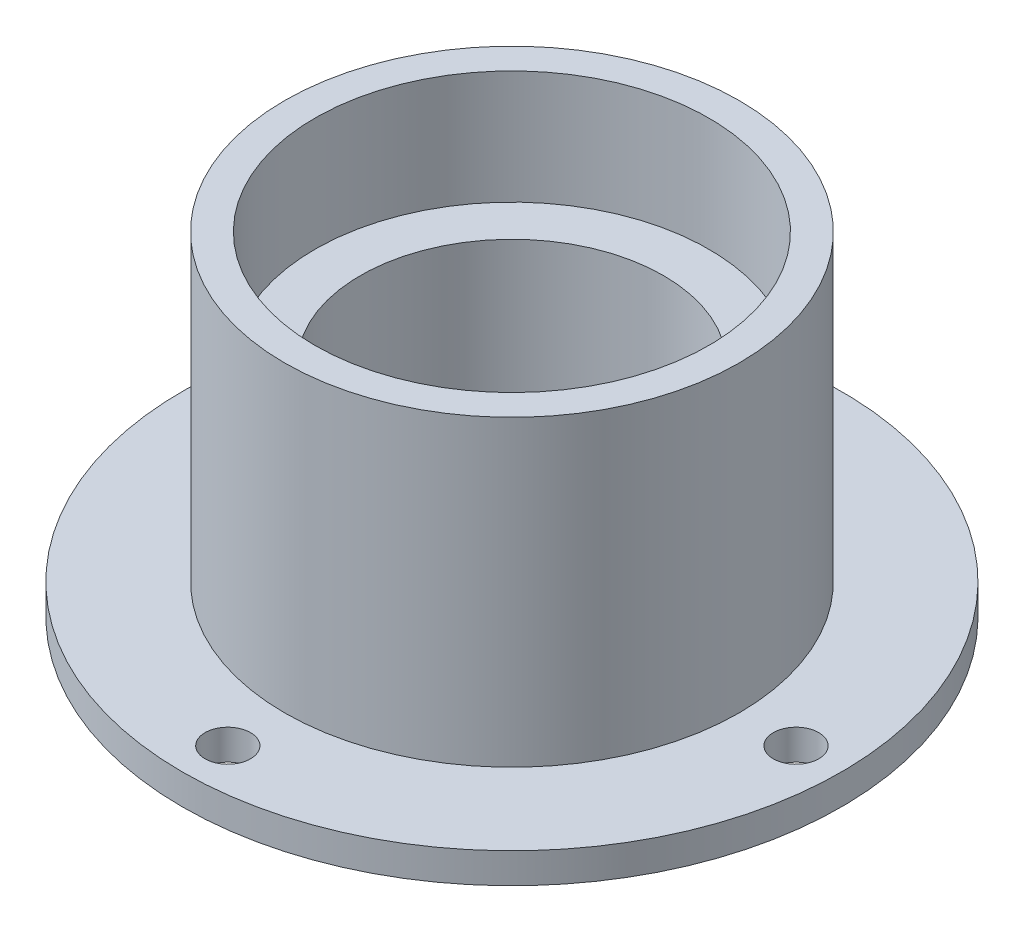
from build123d import *

# Parameters (mm, degrees)
CROQUIS1_R              = 43.5
CROQUIS1_R_2            = 30
SALIENTE_EXTRUIR1_DEPTH = 4
CROQUIS2_R              = 30
CROQUIS2_R_2            = 20
SALIENTE_EXTRUIR2_DEPTH = 44
CROQUIS3_R              = 30
CROQUIS3_R_2            = 20
CORTAR_EXTRUIR1_DEPTH   = 2
CROQUIS4_R              = 26
CORTAR_EXTRUIR2_DEPTH   = 15
CROQUIS5_R              = 3
CORTAR_EXTRUIR3_DEPTH   = 4


with BuildPart() as part:
    # Croquis1 → Saliente-Extruir1 (new body)
    with BuildSketch(Plane(origin=(0, 0, 0), x_dir=(1, 0, 0), z_dir=(0, 1, 0))):
        with Locations(Location((0, 0, 0), (0, 0, 270))):
            Circle(CROQUIS1_R)
        with Locations(Location((0, 0, 0), (0, 0, 270))):
            Circle(CROQUIS1_R_2, mode=Mode.SUBTRACT)
    extrude(amount=SALIENTE_EXTRUIR1_DEPTH)

    # Croquis2 → Saliente-Extruir2 (add)
    with BuildSketch(Plane(origin=(0, 0, 0), x_dir=(1, 0, 0), z_dir=(0, 1, 0))):
        with Locations(Location((0, 0, 0), (0, 0, 270))):
            Circle(CROQUIS2_R)
        with Locations(Location((0, 0, 0), (0, 0, 270))):
            Circle(CROQUIS2_R_2, mode=Mode.SUBTRACT)
    extrude(amount=SALIENTE_EXTRUIR2_DEPTH)

    # Croquis3 → Cortar-Extruir1 (cut)
    with BuildSketch(Plane(origin=(0, 0, 0), x_dir=(1, 0, 0), z_dir=(0, 1, 0))):
        with Locations(Location((0, 0, 0), (0, 0, 270))):
            Circle(CROQUIS3_R)
        with Locations(Location((0, 0, 0), (0, 0, 270))):
            Circle(CROQUIS3_R_2, mode=Mode.SUBTRACT)
    extrude(amount=CORTAR_EXTRUIR1_DEPTH, mode=Mode.SUBTRACT)

    # Croquis4 → Cortar-Extruir2 (cut)
    with BuildSketch(Plane(origin=(0, 44, 0), x_dir=(1, 0, 0), z_dir=(0, 1, 0))):
        with Locations(Location((0, 0, 0), (0, 0, 270))):
            Circle(CROQUIS4_R)
    extrude(amount=-CORTAR_EXTRUIR2_DEPTH, mode=Mode.SUBTRACT)

    # Croquis5 → Cortar-Extruir3 (cut)
    with BuildSketch(Plane(origin=(0, 0, 0), x_dir=(1, 0, 0), z_dir=(0, 1, 0))):
        with Locations(Location((0, -37.5, 0), (0, 0, 270))):
            Circle(CROQUIS5_R)
        with Locations(Location((-37.5, 0, 0), (0, 0, 270))):
            Circle(CROQUIS5_R)
        with Locations(Location((0, 37.5, 0), (0, 0, 270))):
            Circle(CROQUIS5_R)
        with Locations(Location((37.5, 0, 0), (0, 0, 270))):
            Circle(CROQUIS5_R)
    extrude(amount=CORTAR_EXTRUIR3_DEPTH, mode=Mode.SUBTRACT)


solid = part.part
